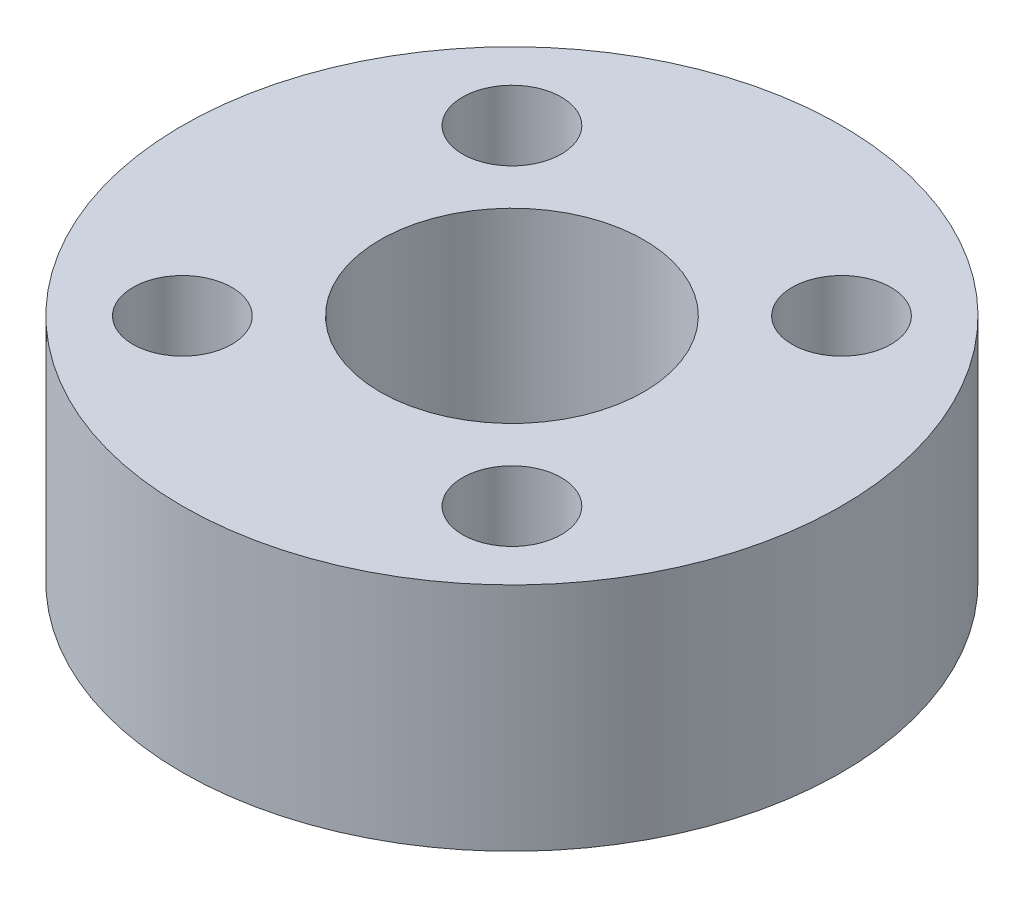
from build123d import *

# Parameters (mm, degrees)
SKETCH_1_R          = 10
EXTRUDE_1_DEPTH     = 7
SKETCH_2_R          = 4
SKETCH_2_R_2        = 1.5
CUT_EXTRUDE_1_DEPTH = 7


with BuildPart() as part:
    # 草图1 → 凸台-拉伸1 (new body)
    with BuildSketch(Plane(origin=(0, 0, 0), x_dir=(1, 0, 0), z_dir=(0, 1, 0))):
        with Locations(Location((0, 0, 0), (0, 0, 270))):
            Circle(SKETCH_1_R)
    extrude(amount=EXTRUDE_1_DEPTH)

    # 草图2 → 切除-拉伸1 (cut)
    with BuildSketch(Plane(origin=(0, 7, 0), x_dir=(1, 0, 0), z_dir=(0, 1, 0))):
        with Locations(Location((0, 0, 0), (0, 0, 270))):
            Circle(SKETCH_2_R)
        with Locations(Location((-5, 5, 0), (0, 0, 270))):
            Circle(SKETCH_2_R_2)
        with Locations(Location((-5, -5, 0), (0, 0, 270))):
            Circle(SKETCH_2_R_2)
        with Locations(Location((5, -5, 0), (0, 0, 270))):
            Circle(SKETCH_2_R_2)
        with Locations(Location((5, 5, 0), (0, 0, 270))):
            Circle(SKETCH_2_R_2)
    extrude(amount=-CUT_EXTRUDE_1_DEPTH, mode=Mode.SUBTRACT)


solid = part.part
